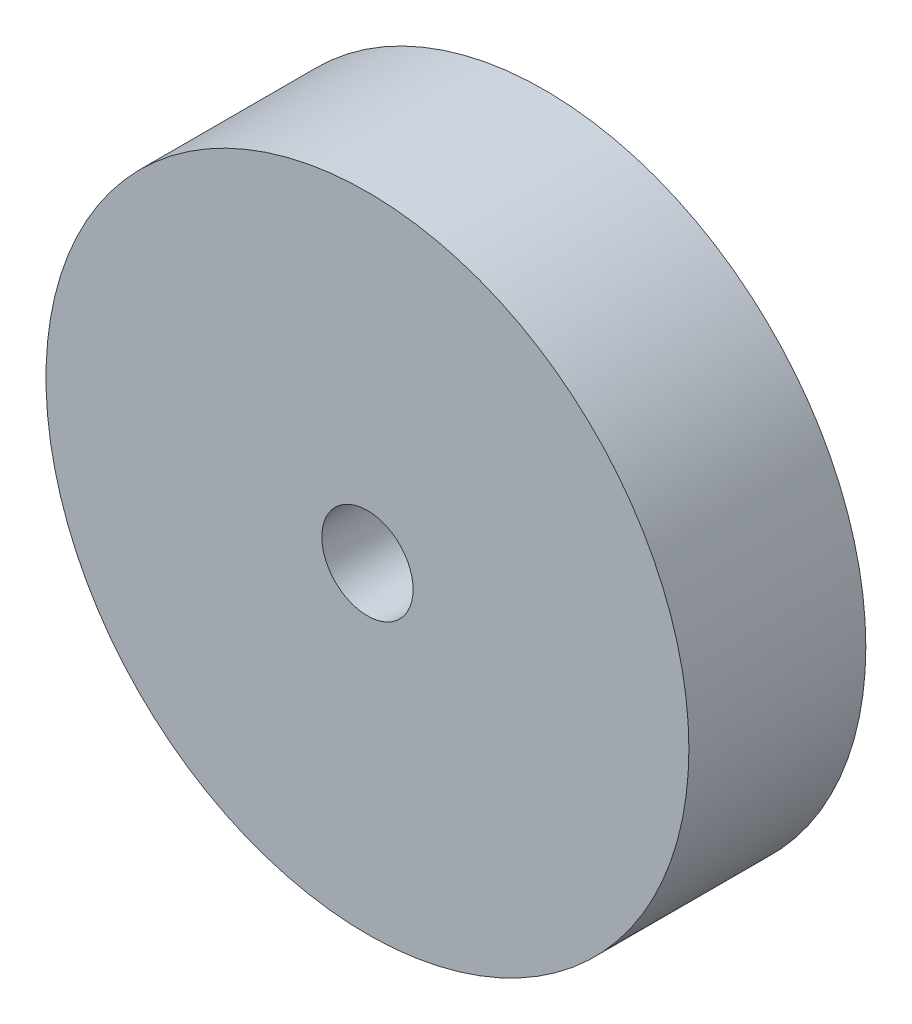
from build123d import *

# Parameters (mm, degrees)
SKETCH1_R           = 12.5
SKETCH1_R_2         = 1.775
BOSS_EXTRUDE1_DEPTH = 6.88


with BuildPart() as part:
    # Sketch1 → Boss-Extrude1 (new body)
    with BuildSketch(Plane.XY):
        Circle(SKETCH1_R)
        Circle(SKETCH1_R_2, mode=Mode.SUBTRACT)
    extrude(amount=BOSS_EXTRUDE1_DEPTH)


solid = part.part
